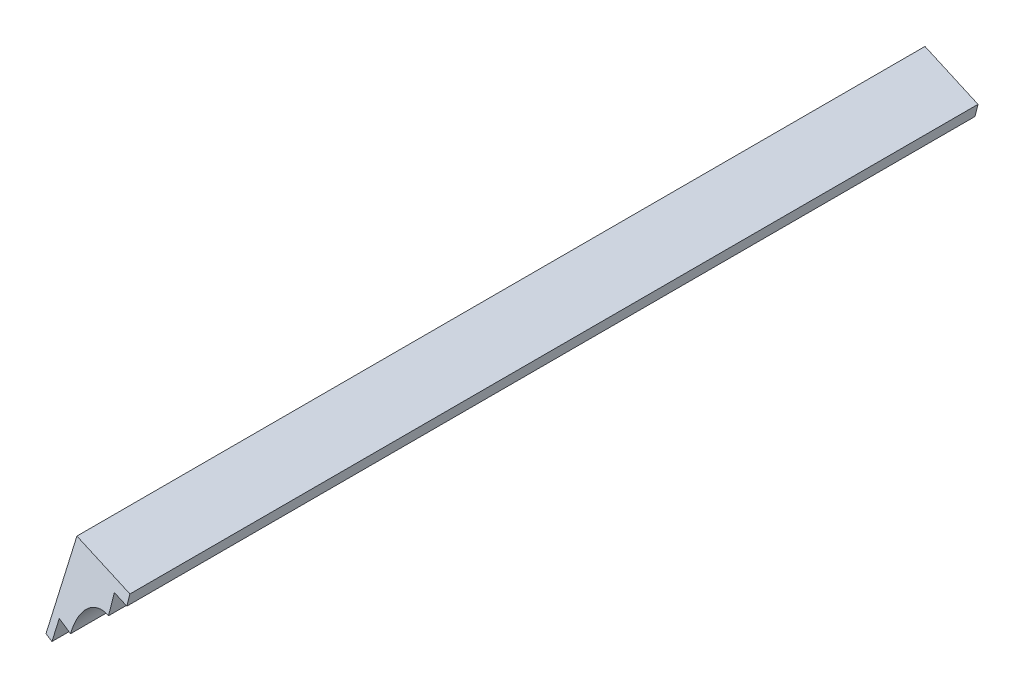
from build123d import *

# Parameters (mm, degrees)
BOSS_EXTRUDE2_DEPTH      = 514
BOSS_EXTRUDE2_DEPTH_BACK = 40
CUT_EXTRUDE1_DEPTH       = 3636.875029428
CUT_EXTRUDE1_DEPTH_BACK  = 3636.875029428


with BuildPart() as part:
    # Sketch1 → Boss-Extrude2 (new, two sides: drawn at the far end of the back side and taken through both)
    with BuildSketch(Plane.XY.offset(-BOSS_EXTRUDE2_DEPTH_BACK)):
        with BuildLine():
            Line((14.404810003, 5.178419046), (14.404810003, 14.708419046))
            Line((14.404810003, 14.708419046), (24.404810003, 14.708419046))
            Line((24.404810003, 14.708419046), (24.404810003, 19.708419046))
            Line((24.404810003, 19.708419046), (-17.916389143, 19.708419046))
            Line((-17.916389143, 19.708419046), (-21.938692577, -22.421202033))
            Line((-21.938692577, -22.421202033), (-16.961326395, -22.896413454))
            Line((-16.961326395, -22.896413454), (-16.010903554, -12.941681091))
            Line((-16.010903554, -12.941681091), (-6.524043612, -13.847434058))
            ThreePointArc((-6.524043612, -13.847434058), (0, 0), (14.404810003, 5.178419046))
        make_face()
    extrude(amount=BOSS_EXTRUDE2_DEPTH + BOSS_EXTRUDE2_DEPTH_BACK)

    # Sketch2 → Cut-Extrude1 (cut, two sides: drawn at the far end of the back side and taken through both)
    with BuildSketch(Plane(origin=(-738.20187256, 812.038169561, 3415.561100518), x_dir=(-0.955618514406147, 0, -0.2946069498911878), z_dir=(0.0908241663548398, 0.9512926552232807, -0.29460694989118763)).offset(-CUT_EXTRUDE1_DEPTH_BACK)):
        Polygon((69.88483537, -3135.609871351), (246.824126872, -3135.609871351), (167.605357186, -3034.434147623), align=None)
        Polygon((236.262195777, -3561.307235785), (313.780261045, -3654.403893751), (393.908665817, -3561.307235785), align=None)
    extrude(amount=CUT_EXTRUDE1_DEPTH + CUT_EXTRUDE1_DEPTH_BACK, mode=Mode.SUBTRACT)


solid = part.part
